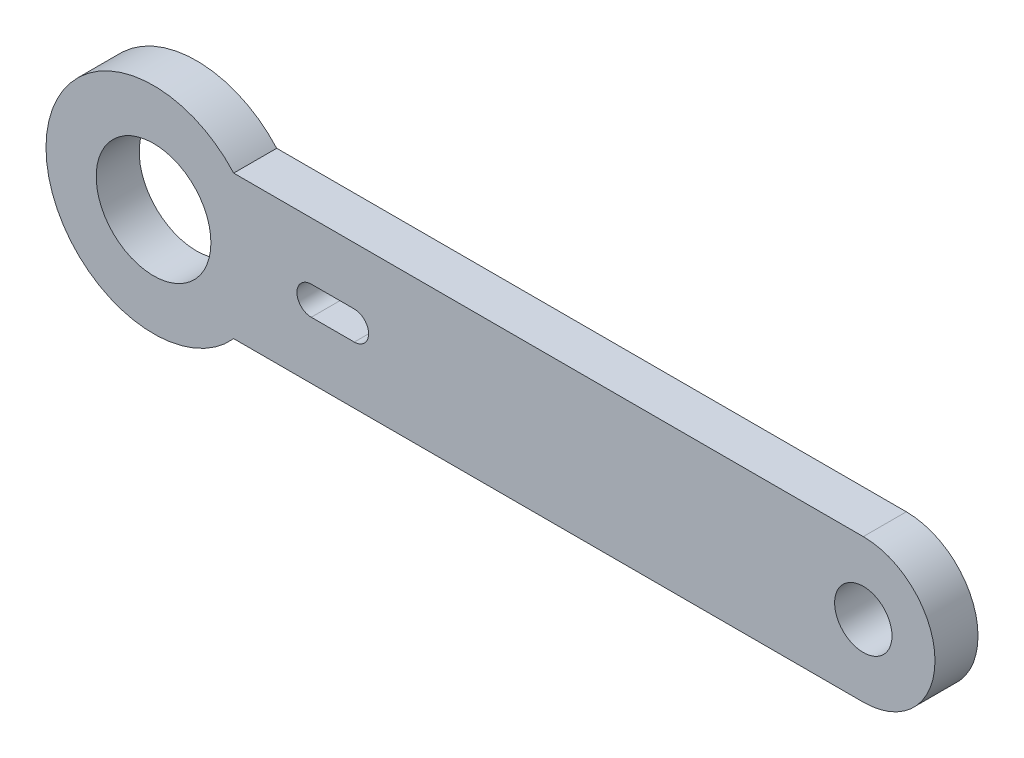
from build123d import *

# Parameters (mm, degrees)
SKETCH_1_R      = 4
SKETCH_1_R_2    = 2
EXTRUDE_1_DEPTH = 1.5


with BuildPart() as part:
    # 草图1 → 凸台-拉伸1 (new, symmetric)
    with BuildSketch(Plane.XY):
        with BuildLine():
            Line((5.590169944, 5), (49.5, 5))
            ThreePointArc((49.5, 5), (54.5, 0), (49.5, -5))
            Line((49.5, -5), (5.590169944, -5))
            ThreePointArc((5.590169944, -5), (-7.5, 0), (5.590169944, 5))
        make_face()
        Circle(SKETCH_1_R, mode=Mode.SUBTRACT)
        with Locations((49.5, 0)):
            Circle(SKETCH_1_R_2, mode=Mode.SUBTRACT)
        with BuildLine():
            Line((11, 1), (14, 1))
            ThreePointArc((14, 1), (15, 0), (14, -1))
            Line((14, -1), (11, -1))
            ThreePointArc((11, -1), (10, 0), (11, 1))
        make_face(mode=Mode.SUBTRACT)
    extrude(amount=EXTRUDE_1_DEPTH, both=True)


solid = part.part
